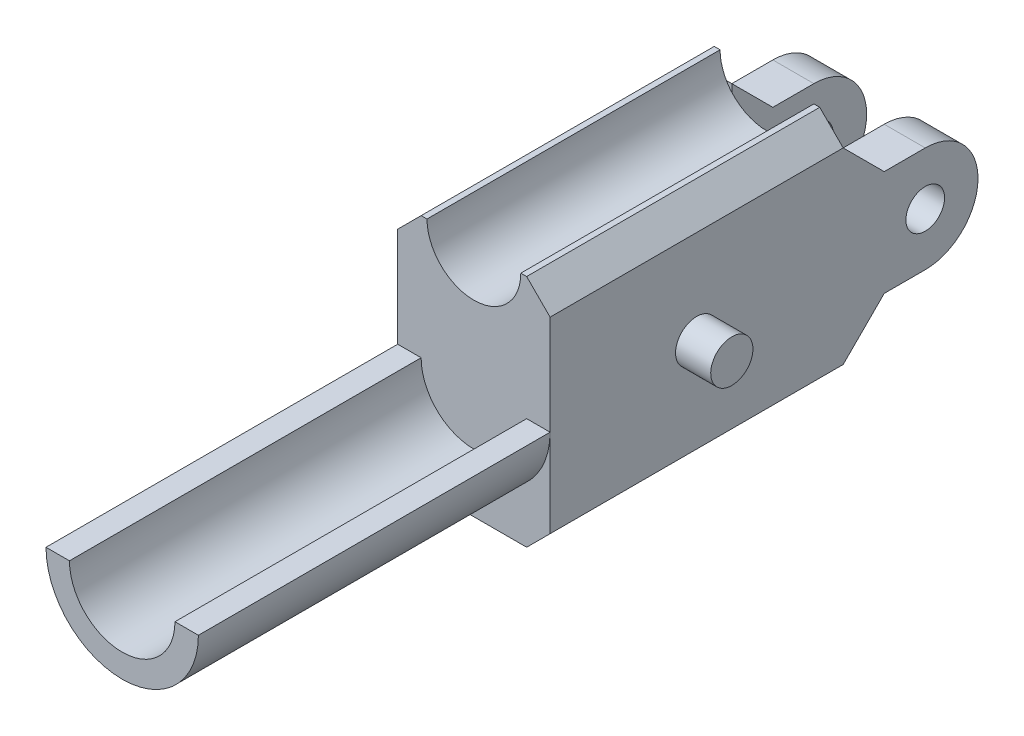
from build123d import *

# Parameters (mm, degrees)
BOSS_EXTRUDE1_DEPTH     = 30
SKETCH2_W               = 13
SKETCH2_H               = 20
BOSS_EXTRUDE2_DEPTH     = 25
CHAMFER1_SIZE           = 2
SKETCH3_R               = 4
CUT_EXTRUDE1_DEPTH      = 40
SKETCH4_R               = 1.8
BOSS_EXTRUDE3_DEPTH     = 9.5
BOSS_EXTRUDE4_REACH     = 37.584
SKETCH5_R               = 1.65
CUT_EXTRUDE2_DEPTH      = 41.40730132
CUT_EXTRUDE2_DEPTH_BACK = 41.40730132
SKETCH6_W               = 6
SKETCH6_H               = 11.5


with BuildPart() as part:
    # Sketch1 → Boss-Extrude1 (new body)
    with BuildSketch(Plane.XY):
        with BuildLine():
            Line((6.5, 0), (4.5, 0))
            ThreePointArc((4.5, 0), (0, -4.5), (-4.5, 0))
            Line((-4.5, 0), (-6.5, 0))
            ThreePointArc((-6.5, 0), (0, -6.5), (6.5, 0))
        make_face()
    extrude(amount=BOSS_EXTRUDE1_DEPTH)

    # Sketch2 → Boss-Extrude2 (add)
    with BuildSketch(Plane(origin=(0, 0, 0), x_dir=(-1, 0, 0), z_dir=(0, 0, -1))):
        with Locations((0, 0.5)):
            Rectangle(SKETCH2_W, SKETCH2_H)
    extrude(amount=BOSS_EXTRUDE2_DEPTH)

    # Chamfer1
    chamfer1_edges = [part.edges().sort_by_distance(p)[0] for p in [
        (6.5, 10.5, -12.5),
        (6.5, -9.5, -12.5),
        (-6.5, -9.5, -12.5),
        (-6.5, 10.5, -12.5),
    ]]
    chamfer(chamfer1_edges, length=CHAMFER1_SIZE)

    # Sketch3 → Cut-Extrude1 (cut)
    with BuildSketch(Plane(origin=(0, 0, -25), x_dir=(-1, 0, 0), z_dir=(0, 0, -1))):
        with Locations((0, 10.5)):
            Circle(SKETCH3_R)
    extrude(amount=-CUT_EXTRUDE1_DEPTH, mode=Mode.SUBTRACT)

    # Sketch4 → Boss-Extrude3 (add, symmetric)
    with BuildSketch(Plane(origin=(0, 0, 0), x_dir=(0, 0, -1), z_dir=(1, 0, 0))):
        with Locations(Location((12.5, 0.5, 0), (0, 0, 90))):
            Circle(SKETCH4_R)
    extrude(amount=BOSS_EXTRUDE3_DEPTH, both=True)

    # Boss-Extrude4: up to this face of the body (flat: up to its plane)
    boss_extrude4_end = Plane(part.part.faces().sort_by_distance((-6.5, -3.75, -0.296816442))[0])
    # Sketch5 → Boss-Extrude4 (add, up to the picked face)
    with BuildSketch(Plane(origin=(6.5, 0, 0), x_dir=(0, 0, -1), z_dir=(1, 0, 0)), mode=Mode.PRIVATE) as boss_extrude4_sk1:
        with BuildLine():
            Line((32, 5), (28.5, 5))
            Line((28.5, 5), (25, 8.5))
            Line((25, 8.5), (25, -7.5))
            Line((25, -7.5), (28.5, -4))
            Line((28.5, -4), (32, -4))
            ThreePointArc((32, -4), (36.5, 0.5), (32, 5))
        make_face()
        with Locations(Location((32, 0.5, 0), (0, 0, 90))):
            Circle(SKETCH5_R, mode=Mode.SUBTRACT)
    boss_extrude4_tool1 = split(extrude(boss_extrude4_sk1.sketch, amount=-BOSS_EXTRUDE4_REACH, mode=Mode.PRIVATE), bisect_by=boss_extrude4_end, keep=Keep.BOTH, mode=Mode.PRIVATE)
    add(boss_extrude4_tool1.solids().sort_by(Axis((6.5, 0.5, -29.652842), (-1, 0, 0)))[0])

    # Sketch6 → Cut-Extrude2 (cut, two sides: drawn at the far end of the back side and taken through both)
    with BuildSketch(Plane(origin=(0, 5, 0), x_dir=(1, 0, 0), z_dir=(0, 1, 0)).offset(-CUT_EXTRUDE2_DEPTH_BACK)):
        with Locations((0, 30.75)):
            Rectangle(SKETCH6_W, SKETCH6_H)
    extrude(amount=CUT_EXTRUDE2_DEPTH + CUT_EXTRUDE2_DEPTH_BACK, mode=Mode.SUBTRACT)


solid = part.part
